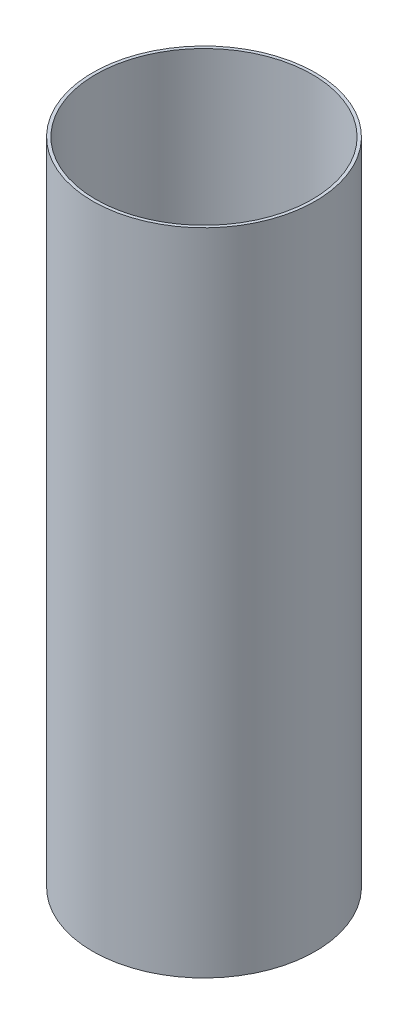
from build123d import *

# Parameters (mm, degrees)
SKETCH1_R           = 78.359
SKETCH1_R_2         = 76.2
BOSS_EXTRUDE1_DEPTH = 457.2


with BuildPart() as part:
    # Sketch1 → Boss-Extrude1 (new body)
    with BuildSketch(Plane(origin=(0, 0, 0), x_dir=(1, 0, 0), z_dir=(0, 1, 0))):
        with Locations(Location((0, 0, 0), (0, 0, 270))):
            Circle(SKETCH1_R)
        with Locations(Location((0, 0, 0), (0, 0, 270))):
            Circle(SKETCH1_R_2, mode=Mode.SUBTRACT)
    extrude(amount=BOSS_EXTRUDE1_DEPTH)


solid = part.part
